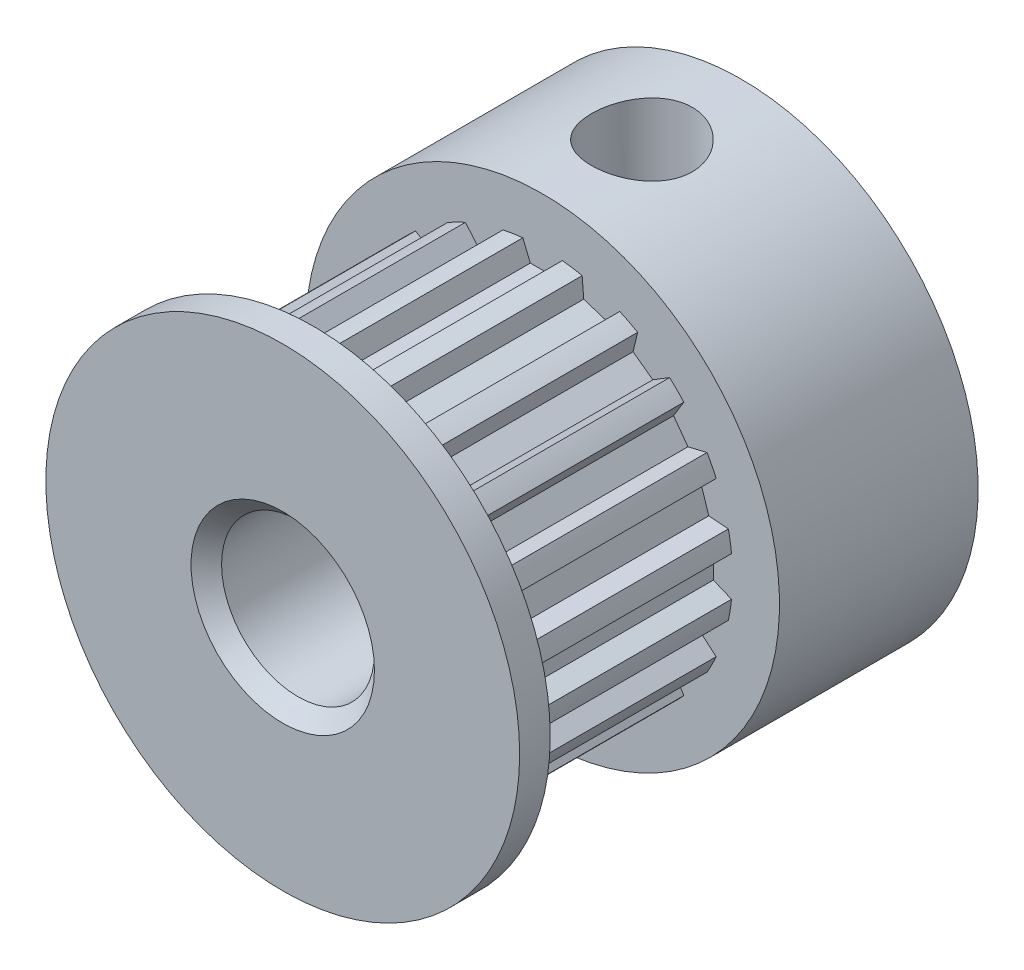
from build123d import *

# Parameters (mm, degrees)
CROQUIS1_W                          = 7.75
CROQUIS1_H                          = 6.5
SALIENTE_EXTRUIR1_DEPTH             = 7.5
SALIENTE_EXTRUIR2_START             = -1
CROQUIS3_R                          = 7.75
SALIENTE_EXTRUIR2_DEPTH             = 1
DI_METRO_DE_TALADRO_5_0_5_1_D       = 5
TALADRO_DE_MARGEN_PARA_M3_51_REACH  = 22.937
TALADRO_DE_MARGEN_PARA_M3_51_BORE_R = 1.65
CHAFL_N1_SIZE                       = 0.5


with BuildPart() as part:
    # Croquis1 → Revolución1 (revolve)
    with BuildSketch(Plane.XZ, mode=Mode.PRIVATE) as revoluci_n1_sk:
        with Locations((3.875, 3.25)):
            Rectangle(CROQUIS1_W, CROQUIS1_H)
    revolve(revoluci_n1_sk.sketch.rotate(Axis((0, 0, 6.5), (0, 0, -1)), 180), axis=Axis((0, 0, 6.5), (0, 0, -1)))

    # Croquis2 → Saliente-Extruir1 (add)
    with BuildSketch(Plane.XY.offset(6.5)):
        with BuildLine():
            Line((5.190170014, 2.106973354), (5.437383609, 1.346128141))
            Line((5.437383609, 1.346128141), (6.078441347, 1.295675803))
            ThreePointArc((6.078441347, 1.295675803), (6.138483037, 0.9722402), (6.181327095, 0.64608076))
            Line((6.181327095, 0.64608076), (5.587235585, 0.4))
            Line((5.587235585, 0.4), (5.587235585, -0.4))
            Line((5.587235585, -0.4), (6.181327095, -0.64608076))
            ThreePointArc((6.181327095, -0.64608076), (6.138483037, -0.9722402), (6.078441347, -1.295675803))
            Line((6.078441347, -1.295675803), (5.437383609, -1.346128141))
            Line((5.437383609, -1.346128141), (5.190170014, -2.106973354))
            Line((5.190170014, -2.106973354), (5.679141478, -2.524594437))
            ThreePointArc((5.679141478, -2.524594437), (5.537605548, -2.821550956), (5.38055541, -3.110602591))
            Line((5.38055541, -3.110602591), (4.755282641, -2.96048788))
            Line((4.755282641, -2.96048788), (4.285054439, -3.607701476))
            Line((4.285054439, -3.607701476), (4.621041925, -4.155983221))
            ThreePointArc((4.621041925, -4.155983221), (4.394668645, -4.394668645), (4.155983221, -4.621041925))
            Line((4.155983221, -4.621041925), (3.607701476, -4.285054439))
            Line((3.607701476, -4.285054439), (2.96048788, -4.755282641))
            Line((2.96048788, -4.755282641), (3.110602591, -5.38055541))
            ThreePointArc((3.110602591, -5.38055541), (2.821550956, -5.537605548), (2.524594437, -5.679141478))
            Line((2.524594437, -5.679141478), (2.106973354, -5.190170014))
            Line((2.106973354, -5.190170014), (1.346128141, -5.437383609))
            Line((1.346128141, -5.437383609), (1.295675803, -6.078441347))
            ThreePointArc((1.295675803, -6.078441347), (0.9722402, -6.138483037), (0.64608076, -6.181327095))
            Line((0.64608076, -6.181327095), (0.4, -5.587235585))
            Line((0.4, -5.587235585), (-0.4, -5.587235585))
            Line((-0.4, -5.587235585), (-0.64608076, -6.181327095))
            ThreePointArc((-0.64608076, -6.181327095), (-0.9722402, -6.138483037), (-1.295675803, -6.078441347))
            Line((-1.295675803, -6.078441347), (-1.346128141, -5.437383609))
            Line((-1.346128141, -5.437383609), (-2.106973354, -5.190170014))
            Line((-2.106973354, -5.190170014), (-2.524594437, -5.679141478))
            ThreePointArc((-2.524594437, -5.679141478), (-2.821550956, -5.537605548), (-3.110602591, -5.38055541))
            Line((-3.110602591, -5.38055541), (-2.96048788, -4.755282641))
            Line((-2.96048788, -4.755282641), (-3.607701476, -4.285054439))
            Line((-3.607701476, -4.285054439), (-4.155983221, -4.621041925))
            ThreePointArc((-4.155983221, -4.621041925), (-4.394668645, -4.394668645), (-4.621041925, -4.155983221))
            Line((-4.621041925, -4.155983221), (-4.285054439, -3.607701476))
            Line((-4.285054439, -3.607701476), (-4.755282641, -2.96048788))
            Line((-4.755282641, -2.96048788), (-5.38055541, -3.110602591))
            ThreePointArc((-5.38055541, -3.110602591), (-5.537605548, -2.821550956), (-5.679141478, -2.524594437))
            Line((-5.679141478, -2.524594437), (-5.190170014, -2.106973354))
            Line((-5.190170014, -2.106973354), (-5.437383609, -1.346128141))
            Line((-5.437383609, -1.346128141), (-6.078441347, -1.295675803))
            ThreePointArc((-6.078441347, -1.295675803), (-6.138483037, -0.9722402), (-6.181327095, -0.64608076))
            Line((-6.181327095, -0.64608076), (-5.587235585, -0.4))
            Line((-5.587235585, -0.4), (-5.587235585, 0.4))
            Line((-5.587235585, 0.4), (-6.181327095, 0.64608076))
            ThreePointArc((-6.181327095, 0.64608076), (-6.138483037, 0.9722402), (-6.078441347, 1.295675803))
            Line((-6.078441347, 1.295675803), (-5.437383609, 1.346128141))
            Line((-5.437383609, 1.346128141), (-5.190170014, 2.106973354))
            Line((-5.190170014, 2.106973354), (-5.679141478, 2.524594437))
            ThreePointArc((-5.679141478, 2.524594437), (-5.537605548, 2.821550956), (-5.38055541, 3.110602591))
            Line((-5.38055541, 3.110602591), (-4.755282641, 2.96048788))
            Line((-4.755282641, 2.96048788), (-4.285054439, 3.607701476))
            Line((-4.285054439, 3.607701476), (-4.621041925, 4.155983221))
            ThreePointArc((-4.621041925, 4.155983221), (-4.394668645, 4.394668645), (-4.155983221, 4.621041925))
            Line((-4.155983221, 4.621041925), (-3.607701476, 4.285054439))
            Line((-3.607701476, 4.285054439), (-2.96048788, 4.755282641))
            Line((-2.96048788, 4.755282641), (-3.110602591, 5.38055541))
            ThreePointArc((-3.110602591, 5.38055541), (-2.821550956, 5.537605548), (-2.524594437, 5.679141478))
            Line((-2.524594437, 5.679141478), (-2.106973354, 5.190170014))
            Line((-2.106973354, 5.190170014), (-1.346128141, 5.437383609))
            Line((-1.346128141, 5.437383609), (-1.295675803, 6.078441347))
            ThreePointArc((-1.295675803, 6.078441347), (-0.9722402, 6.138483037), (-0.64608076, 6.181327095))
            Line((-0.64608076, 6.181327095), (-0.4, 5.587235585))
            Line((-0.4, 5.587235585), (0.4, 5.587235585))
            Line((0.4, 5.587235585), (0.64608076, 6.181327095))
            ThreePointArc((0.64608076, 6.181327095), (0.9722402, 6.138483037), (1.295675803, 6.078441347))
            Line((1.295675803, 6.078441347), (1.346128141, 5.437383609))
            Line((1.346128141, 5.437383609), (2.106973354, 5.190170014))
            Line((2.106973354, 5.190170014), (2.524594437, 5.679141478))
            ThreePointArc((2.524594437, 5.679141478), (2.821550956, 5.537605548), (3.110602591, 5.38055541))
            Line((3.110602591, 5.38055541), (2.96048788, 4.755282641))
            Line((2.96048788, 4.755282641), (3.607701476, 4.285054439))
            Line((3.607701476, 4.285054439), (4.155983221, 4.621041925))
            ThreePointArc((4.155983221, 4.621041925), (4.394668645, 4.394668645), (4.621041925, 4.155983221))
            Line((4.621041925, 4.155983221), (4.285054439, 3.607701476))
            Line((4.285054439, 3.607701476), (4.755282641, 2.96048788))
            Line((4.755282641, 2.96048788), (5.38055541, 3.110602591))
            ThreePointArc((5.38055541, 3.110602591), (5.537605548, 2.821550956), (5.679141478, 2.524594437))
            Line((5.679141478, 2.524594437), (5.190170014, 2.106973354))
        make_face()
    extrude(amount=SALIENTE_EXTRUIR1_DEPTH)

    # Croquis3 → Saliente-Extruir2 (add)
    with BuildSketch(Plane(origin=(0, 0, 14), x_dir=(-1, 0, 0), z_dir=(0, 0, -1)).offset(SALIENTE_EXTRUIR2_START)):
        Circle(CROQUIS3_R)
    extrude(amount=SALIENTE_EXTRUIR2_DEPTH)

    # Diámetro de taladro Ø5.0 (5)1 (through all)
    with Locations(Plane(origin=(0, 0, 0), x_dir=(-1, 0, 0), z_dir=(0, 0, -1))):
        with Locations((0, 0)):
            Hole(DI_METRO_DE_TALADRO_5_0_5_1_D / 2)

    # Taladro de margen para M3.51 bore (on position points) → Taladro de margen para M3.51 (cut, up to next)
    with BuildSketch(Plane(origin=(0, 7.75, 3.25), x_dir=(1, 0, 0), z_dir=(0, 1, 0)), mode=Mode.PRIVATE) as taladro_de_margen_para_m3_51_sk1:
        Circle(TALADRO_DE_MARGEN_PARA_M3_51_BORE_R)
    taladro_de_margen_para_m3_51_tool1 = extrude(taladro_de_margen_para_m3_51_sk1.sketch, amount=-TALADRO_DE_MARGEN_PARA_M3_51_REACH, mode=Mode.PRIVATE) & part.part
    add(taladro_de_margen_para_m3_51_tool1.solids().sort_by_distance((0, 7.75, 3.25))[0], mode=Mode.SUBTRACT)

    # Chaflán1
    chafl_n1_edges = [part.edges().sort_by_distance(p)[0] for p in [
        (-2.5, 0, 0),
        (-2.5, 0, 15),
    ]]
    chamfer(chafl_n1_edges, length=CHAFL_N1_SIZE)


solid = part.part
